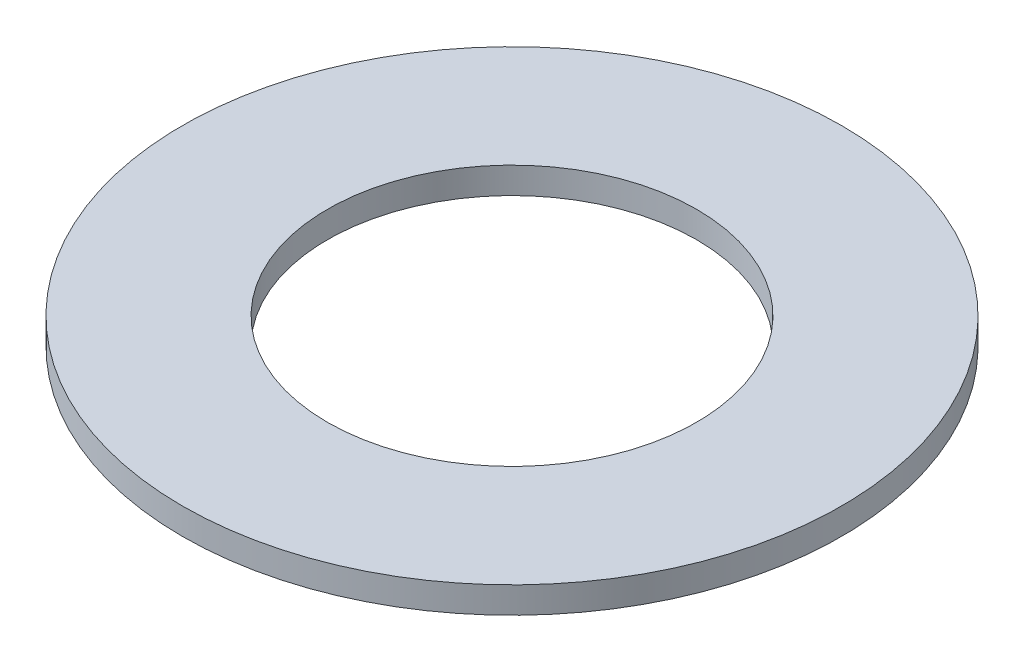
from build123d import *

# Parameters (mm, degrees)
SKETCH1_R           = 12.5
SKETCH1_R_2         = 7
BOSS_EXTRUDE1_DEPTH = 0.5


with BuildPart() as part:
    # Sketch1 → Boss-Extrude1 (new, symmetric)
    with BuildSketch(Plane(origin=(0, 0, 0), x_dir=(1, 0, 0), z_dir=(0, 1, 0))):
        with Locations(Location((0, 0, 0), (0, 0, 270))):
            Circle(SKETCH1_R)
        with Locations(Location((0, 0, 0), (0, 0, 270))):
            Circle(SKETCH1_R_2, mode=Mode.SUBTRACT)
    extrude(amount=BOSS_EXTRUDE1_DEPTH, both=True)


solid = part.part
